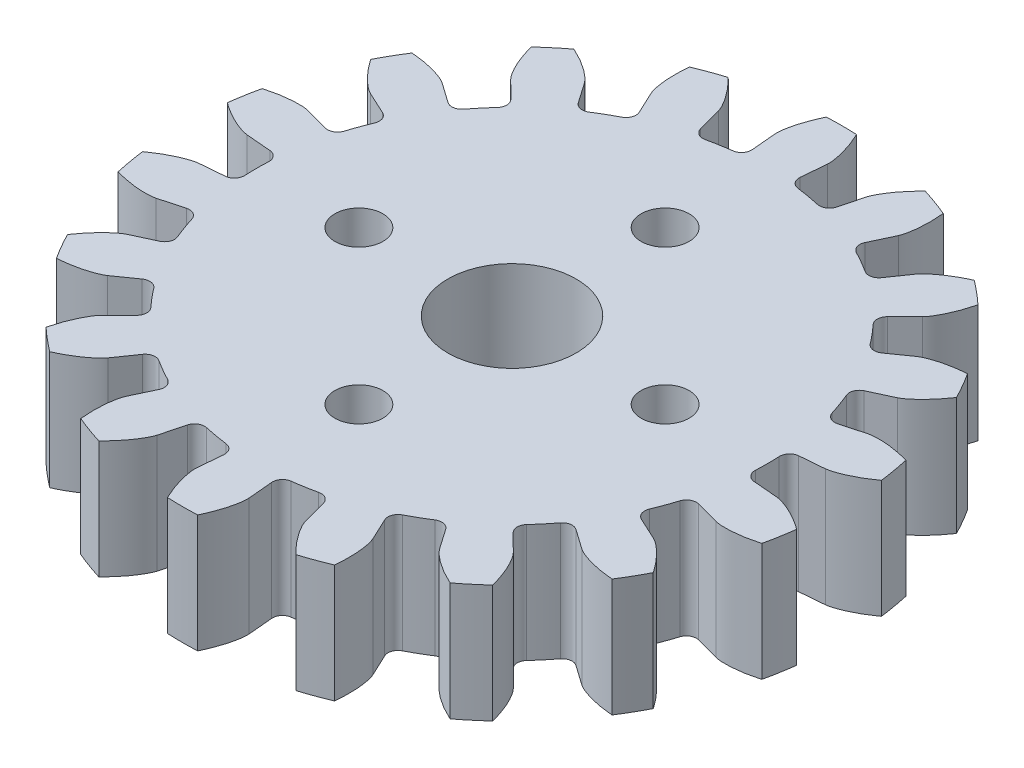
from build123d import *

# Parameters (mm, degrees)
ESQUISSE1_R                        = 14.000044095
BOSS_EXTRU_1_DEPTH                 = 5
ENL_V_MAT_EXTRU_3_DEPTH            = 21.420638318
CONG_1_R                           = 0.422770423
R_P_TITION_CIRCULAIRE2_COUNT       = 18
CONG_1_OF_R_P_TITION_CIRCULAIRE2_R = 0.422770423
ESQUISSE3_R                        = 2.725
ENL_V_MAT_EXTRU_4_DEPTH            = 21.341365586
ESQUISSE4_R                        = 1.02
ENL_V_MAT_EXTRU_5_DEPTH            = 21.341365586
R_P_TITION_CIRCULAIRE3_COUNT       = 4


with BuildPart() as part:
    # Esquisse1 → Boss.-Extru.1 (new body)
    with BuildSketch(Plane(origin=(0, 0, 0), x_dir=(1, 0, 0), z_dir=(0, 1, 0))):
        with Locations(Location((0, 0, 0), (0, 0, 270))):
            Circle(ESQUISSE1_R)
    extrude(amount=BOSS_EXTRU_1_DEPTH)

    # Esquisse2 → Enlèv. mat.-Extru.3 (cut, through all)
    with BuildSketch(Plane(origin=(0, 5, 0), x_dir=(1, 0, 0), z_dir=(0, 1, 0))):
        with BuildLine():
            Line((12.281087975, 1.035892571), (10.811641621, 0.911946829))
            ThreePointArc((10.811641621, 0.911946829), (10.850034173, 0), (10.811641621, -0.911946829))
            Line((10.811641621, -0.911946829), (12.281087975, -1.035892571))
            add(Edge.make_bspline(
                [(12.281087975, -1.035892571), (12.283721622, -1.03614498), (12.291099886, -1.036945956), (12.305014601, -1.038827564), (12.327666255, -1.042419159), (12.356444855, -1.047761279), (12.393538031, -1.055544651), (12.437092926, -1.065842687), (12.484800442, -1.078341614), (12.536522861, -1.093213761), (12.587954628, -1.109176099), (12.639095093, -1.126145404), (12.689884535, -1.143992147), (12.751215391, -1.166722741), (12.824485009, -1.195524273), (12.909706777, -1.231435955), (13.005848803, -1.274813588), (13.103256216, -1.321847846), (13.198620082, -1.370448639), (13.294385897, -1.422212104), (13.386626851, -1.474179327), (13.481802733, -1.530871314), (13.569334125, -1.584581734), (13.666667544, -1.647750343), (13.745004658, -1.699602702), (13.825294357, -1.755655306), (13.864277673, -1.78330344), (13.884160496, -1.79758782)],
                knots=[0, 0, 0, 0, 0, 0.005376749, 0.015083688, 0.02853182, 0.04661014, 0.064854849, 0.092110526, 0.119476176, 0.146842496, 0.174208854, 0.201574956, 0.228941013, 0.256307345, 0.307035032, 0.361767352, 0.416499661, 0.471231937, 0.525964282, 0.580696616, 0.635428982, 0.690161387, 0.744893688, 0.799626082, 0.854358407, 0.909090914, 0.909090914, 0.909090914, 0.909090914, 0.909090914], degree=4))
            ThreePointArc((13.884160496, -1.79758782), (14.000044095, 0), (13.884160496, 1.79758782))
            add(Edge.make_bspline(
                [(12.281087975, 1.035892571), (12.283721622, 1.03614498), (12.291099886, 1.036945956), (12.305014601, 1.038827564), (12.327666255, 1.042419159), (12.356444855, 1.047761279), (12.393538031, 1.055544651), (12.437092926, 1.065842687), (12.484800442, 1.078341614), (12.536522861, 1.093213761), (12.587954628, 1.109176099), (12.639095093, 1.126145404), (12.689884535, 1.143992147), (12.751215391, 1.166722741), (12.824485009, 1.195524273), (12.909706777, 1.231435955), (13.005848803, 1.274813588), (13.103256216, 1.321847846), (13.198620082, 1.370448639), (13.294385897, 1.422212104), (13.386626851, 1.474179327), (13.481802733, 1.530871314), (13.569334125, 1.584581734), (13.666667544, 1.647750343), (13.745004658, 1.699602702), (13.825294357, 1.755655306), (13.864277673, 1.78330344), (13.884160496, 1.79758782)],
                knots=[0, 0, 0, 0, 0, 0.005376749, 0.015083688, 0.02853182, 0.04661014, 0.064854849, 0.092110526, 0.119476176, 0.146842496, 0.174208854, 0.201574956, 0.228941013, 0.256307345, 0.307035032, 0.361767352, 0.416499661, 0.471231937, 0.525964282, 0.580696616, 0.635428982, 0.690161387, 0.744893688, 0.799626082, 0.854358407, 0.909090914, 0.909090914, 0.909090914, 0.909090914, 0.909090914], degree=4))
        make_face()
    enl_v_mat_extru_3 = extrude(amount=-ENL_V_MAT_EXTRU_3_DEPTH, mode=Mode.SUBTRACT)

    # Congé1
    cong_1_edges = [part.edges().sort_by_distance(p)[0] for p in [
        (10.811641621, 2.5, 0.911946829),
        (10.811641621, 2.5, -0.911946829),
    ]]
    fillet(cong_1_edges, radius=CONG_1_R)

    # Répétition circulaire2: Enlèv. mat.-Extru.3 ×18 about axis
    r_p_tition_circulaire2_axis = Axis((0, 5, 0), (0, -1, 0))
    for i in range(1, R_P_TITION_CIRCULAIRE2_COUNT):
        add(enl_v_mat_extru_3.rotate(r_p_tition_circulaire2_axis, i * 360 / R_P_TITION_CIRCULAIRE2_COUNT), mode=Mode.SUBTRACT)

    # Congé1 of Répétition circulaire2
    cong_1_of_r_p_tition_circulaire2_edges = [part.edges().sort_by_distance(p)[0] for p in [
        (9.847715665, 2.5, 4.554748923),
        (10.471524035, 2.5, 2.840849511),
        (7.696009862, 2.5, 7.648181075),
        (8.868386107, 2.5, 6.250997474),
        (4.61605169, 2.5, 9.819129715),
        (6.195589931, 2.5, 8.907182886),
        (0.979329558, 2.5, 10.805746396),
        (2.775514173, 2.5, 10.489030586),
        (-2.775514173, 2.5, 10.489030586),
        (-0.979329558, 2.5, 10.805746396),
        (-6.195589931, 2.5, 8.907182886),
        (-4.61605169, 2.5, 9.819129715),
        (-8.868386107, 2.5, 6.250997474),
        (-7.696009862, 2.5, 7.648181075),
        (-10.471524035, 2.5, 2.840849511),
        (-9.847715665, 2.5, 4.554748923),
        (-10.811641621, 2.5, -0.911946829),
        (-10.811641621, 2.5, 0.911946829),
        (-9.847715665, 2.5, -4.554748923),
        (-10.471524035, 2.5, -2.840849511),
        (-7.696009862, 2.5, -7.648181075),
        (-8.868386107, 2.5, -6.250997474),
        (-4.61605169, 2.5, -9.819129715),
        (-6.195589931, 2.5, -8.907182886),
        (-0.979329558, 2.5, -10.805746396),
        (-2.775514173, 2.5, -10.489030586),
        (2.775514173, 2.5, -10.489030586),
        (0.979329558, 2.5, -10.805746396),
        (6.195589931, 2.5, -8.907182886),
        (4.61605169, 2.5, -9.819129715),
        (8.868386107, 2.5, -6.250997474),
        (7.696009862, 2.5, -7.648181075),
        (10.471524035, 2.5, -2.840849511),
        (9.847715665, 2.5, -4.554748923),
    ]]
    fillet(cong_1_of_r_p_tition_circulaire2_edges, radius=CONG_1_OF_R_P_TITION_CIRCULAIRE2_R)

    # Esquisse3 → Enlèv. mat.-Extru.4 (cut, through all)
    with BuildSketch(Plane(origin=(0, 5, 0), x_dir=(1, 0, 0), z_dir=(0, 1, 0))):
        with Locations(Location((0, 0, 0), (0, 0, 270))):
            Circle(ESQUISSE3_R)
    extrude(amount=-ENL_V_MAT_EXTRU_4_DEPTH, mode=Mode.SUBTRACT)

    # Esquisse4 → Enlèv. mat.-Extru.5 (cut, through all)
    with BuildSketch(Plane(origin=(0, 5, 0), x_dir=(1, 0, 0), z_dir=(0, 1, 0))):
        with Locations(Location((6.5, 0, 0), (0, 0, 270))):
            Circle(ESQUISSE4_R)
    enl_v_mat_extru_5 = extrude(amount=-ENL_V_MAT_EXTRU_5_DEPTH, mode=Mode.SUBTRACT)

    # Répétition circulaire3: Enlèv. mat.-Extru.5 ×4 about axis
    r_p_tition_circulaire3_axis = Axis((0, 0, 0), (0, 1, 0))
    for i in range(1, R_P_TITION_CIRCULAIRE3_COUNT):
        add(enl_v_mat_extru_5.rotate(r_p_tition_circulaire3_axis, i * 360 / R_P_TITION_CIRCULAIRE3_COUNT), mode=Mode.SUBTRACT)


solid = part.part
